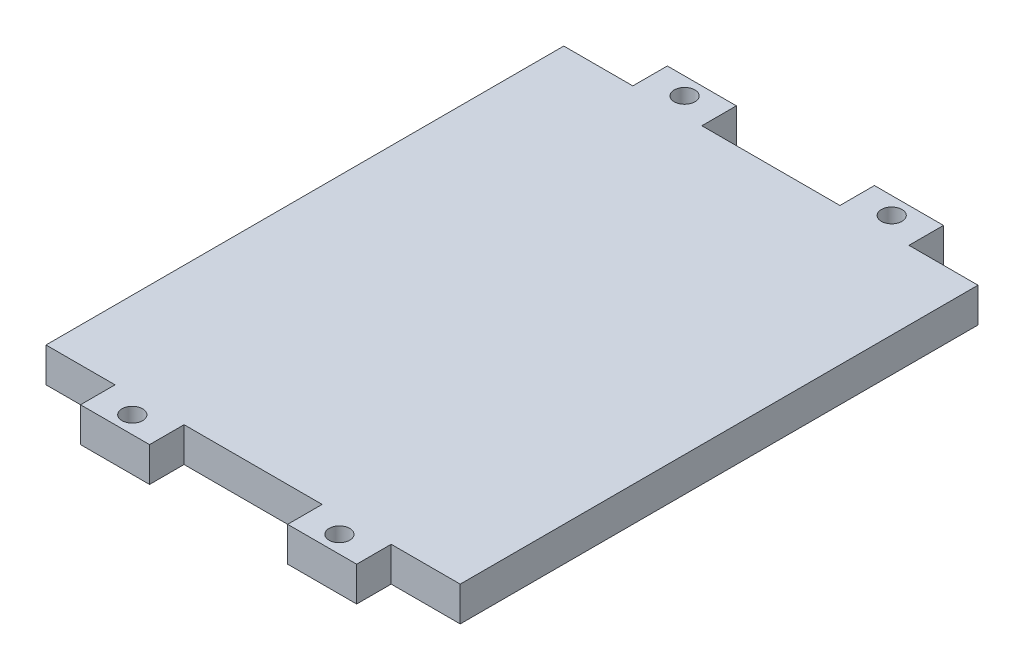
from build123d import *

# Parameters (mm, degrees)
SKETCH1_W                 = 76.2
SKETCH1_H                 = 107.95
BOSS_EXTRUDE1_DEPTH       = 6.35
SKETCH2_R                 = 1.7526
SKETCH2_W                 = 12.7
SKETCH2_H                 = 6.35
SKETCH2_W_2               = 25.4
CUT_EXTRUDE1_DEPTH        = 6.35
F_6_CLEARANCE_HOLE1_D     = 3.7973
F_6_CLEARANCE_HOLE1_DEPTH = 6.35
F_6_CLEARANCE_HOLE1_TIP   = 1.140824014


with BuildPart() as part:
    # Sketch1 → Boss-Extrude1 (new body)
    with BuildSketch(Plane(origin=(0, 0, 0), x_dir=(1, 0, 0), z_dir=(0, 1, 0))):
        Rectangle(SKETCH1_W, SKETCH1_H)
    extrude(amount=BOSS_EXTRUDE1_DEPTH)

    # Sketch2 → Cut-Extrude1 (cut)
    with BuildSketch(Plane(origin=(0, 6.35, 0), x_dir=(1, 0, 0), z_dir=(0, 1, 0))):
        with Locations(Location((-19.05, 50.8, 0), (0, 0, 270))):
            Circle(SKETCH2_R)
        with Locations(Location((19.05, 50.8, 0), (0, 0, 270))):
            Circle(SKETCH2_R)
        with Locations(Location((19.05, -50.8, 0), (0, 0, 90))):
            Circle(SKETCH2_R)
        with Locations(Location((-19.05, -50.8, 0), (0, 0, 90))):
            Circle(SKETCH2_R)
        with Locations((-31.75, 50.8)):
            Rectangle(SKETCH2_W, SKETCH2_H)
        with Locations((0, 50.8)):
            Rectangle(SKETCH2_W_2, SKETCH2_H)
        with Locations((31.75, 50.8)):
            Rectangle(SKETCH2_W, SKETCH2_H)
        with Locations((31.75, -50.8)):
            Rectangle(SKETCH2_W, SKETCH2_H)
        with Locations((0, -50.8)):
            Rectangle(SKETCH2_W_2, SKETCH2_H)
        with Locations((-31.75, -50.8)):
            Rectangle(SKETCH2_W, SKETCH2_H)
    extrude(amount=-CUT_EXTRUDE1_DEPTH, mode=Mode.SUBTRACT)

    # #6 Clearance Hole1
    with Locations(Plane(origin=(0, 6.35, 0), x_dir=(1, 0, 0), z_dir=(0, 1, 0))):
        with Locations((-19.05, 50.8), (19.05, 50.8), (-19.05, -50.8), (19.05, -50.8)):
            Hole(F_6_CLEARANCE_HOLE1_D / 2, depth=F_6_CLEARANCE_HOLE1_DEPTH)
            with Locations((0, 0, -(F_6_CLEARANCE_HOLE1_DEPTH + F_6_CLEARANCE_HOLE1_TIP / 2))):  # 118° drill point
                Cone(0, F_6_CLEARANCE_HOLE1_D / 2, F_6_CLEARANCE_HOLE1_TIP, mode=Mode.SUBTRACT)


solid = part.part
